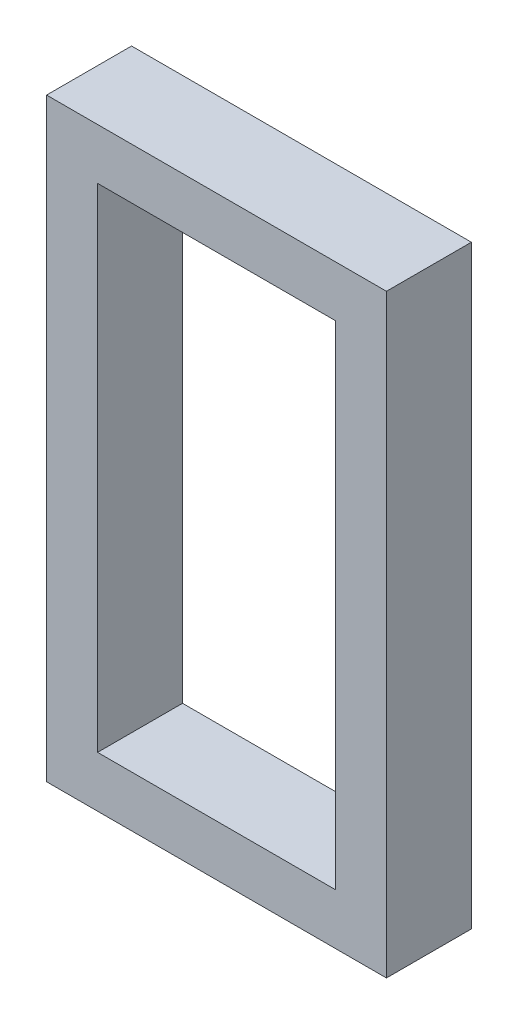
from build123d import *

# Parameters (mm, degrees)
SKETCH1_W           = 25.4
SKETCH1_H           = 44.45
BOSS_EXTRUDE1_DEPTH = 6.35
SKETCH3_W           = 17.78
SKETCH3_H           = 36.83
CUT_EXTRUDE1_DEPTH  = 6.35


with BuildPart() as part:
    # Sketch1 → Boss-Extrude1 (new body)
    with BuildSketch(Plane.XY):
        with Locations((0, 22.225)):
            Rectangle(SKETCH1_W, SKETCH1_H)
    extrude(amount=BOSS_EXTRUDE1_DEPTH)

    # Sketch3 → Cut-Extrude1 (cut)
    with BuildSketch(Plane.XY.offset(6.35)):
        with Locations((0, 22.225)):
            Rectangle(SKETCH3_W, SKETCH3_H)
    extrude(amount=-CUT_EXTRUDE1_DEPTH, mode=Mode.SUBTRACT)


solid = part.part
